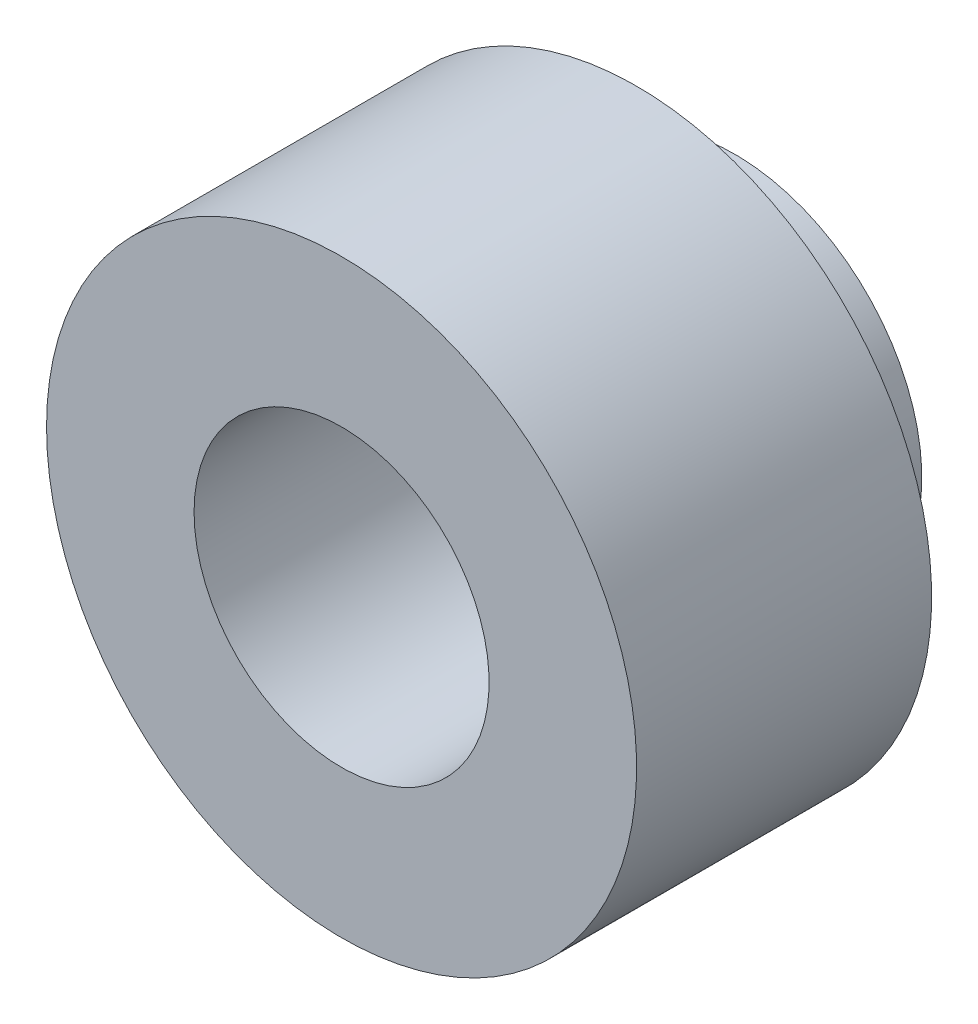
from build123d import *


with BuildPart() as part:
    # Sketch1 → Revolve1 (revolve)
    with BuildSketch(Plane(origin=(0, 0, 0), x_dir=(1, 0, 0), z_dir=(0, 1, 0))):
        Polygon((-187.5, 0), (-375, 0), (-375, 375), (-237.5, 375), (-237.5, 500), (-187.5, 500), align=None)
    revolve(axis=Axis((0, 0, -567.324866616), (0, 0, 1)))


solid = part.part
